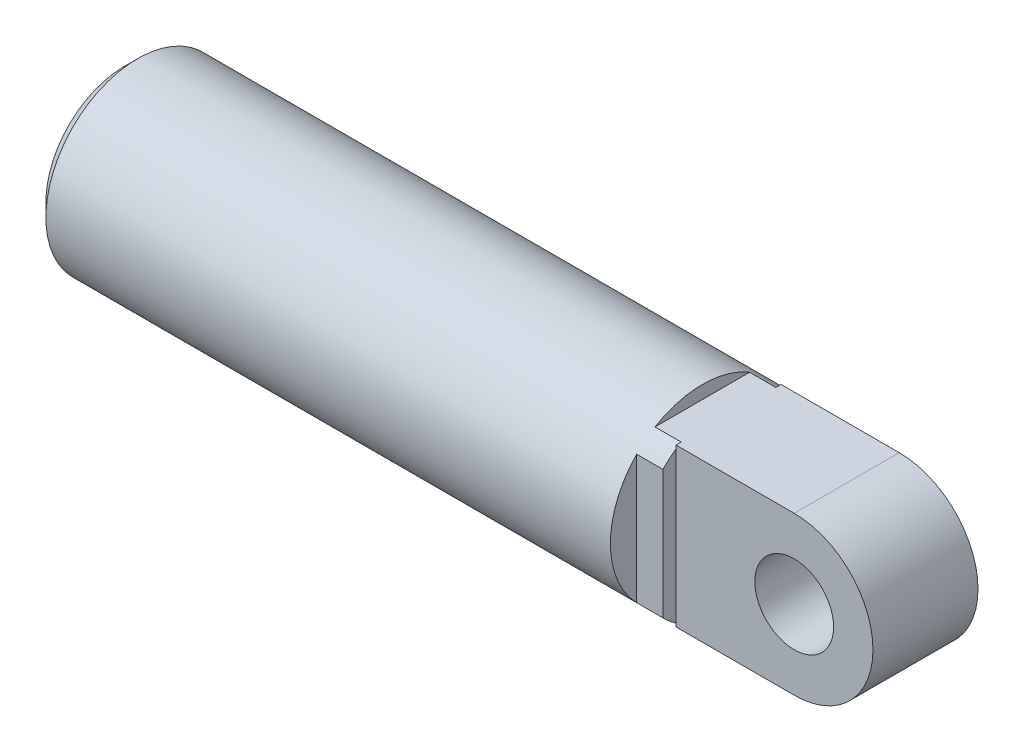
from build123d import *
from build123d.topology import SkipClean

# Parameters (mm, degrees)
SKETCH1_R                   = 7
BOSS_EXTRUDE1_DEPTH         = 44
BOSS_EXTRUDE2_DEPTH         = 2
SKETCH3_R                   = 3
BOSS_EXTRUDE3_DEPTH         = 4
TAP_DRILL_FOR_M5_TAP1_D     = 4.2
TAP_DRILL_FOR_M5_TAP1_DEPTH = 15
TAP_DRILL_FOR_M5_TAP1_TIP   = 1.2618073
CHAMFER1_SIZE               = 1


with BuildPart() as part:
    # Sketch1 → Boss-Extrude1 (new body)
    with BuildSketch(Plane.YZ):
        with Locations(Location((0, 0, 0), (0, 0, 270))):
            Circle(SKETCH1_R)
    extrude(amount=BOSS_EXTRUDE1_DEPTH)

    # Sketch2 → Boss-Extrude2 (add)
    with SkipClean():  # the faces are left unmerged after this step: merging them gives an invalid solid
        with BuildSketch(Plane.YZ.offset(44)):
            with BuildLine():
                Line((-4.898979486, 5), (4.898979486, 5))
                ThreePointArc((4.898979486, 5), (5.4939112, 4.337849667), (6, 3.605551275))
                Line((6, 3.605551275), (6, -3.605551275))
                ThreePointArc((6, -3.605551275), (5.4939112, -4.337849667), (4.898979486, -5))
                Line((4.898979486, -5), (-4.898979486, -5))
                ThreePointArc((-4.898979486, -5), (-5.4939112, -4.337849667), (-6, -3.605551275))
                Line((-6, -3.605551275), (-6, 3.605551275))
                ThreePointArc((-6, 3.605551275), (-5.4939112, 4.337849667), (-4.898979486, 5))
            make_face()
        extrude(amount=BOSS_EXTRUDE2_DEPTH)

    # Sketch3 → Boss-Extrude3 (add, symmetric)
    with SkipClean():  # the faces are left unmerged after this step: merging them gives an invalid solid
        with BuildSketch(Plane(origin=(0, 0, 0), x_dir=(0, 1, 0), z_dir=(0, 0, 1))):
            with BuildLine():
                Line((-6, -46), (6, -46))
                Line((6, -46), (6, -55))
                ThreePointArc((6, -55), (0, -61), (-6, -55))
                Line((-6, -55), (-6, -46))
            make_face()
            with Locations(Location((0, -55, 0), (0, 0, 270))):
                Circle(SKETCH3_R, mode=Mode.SUBTRACT)
        extrude(amount=BOSS_EXTRUDE3_DEPTH, both=True)

    # Tap Drill for M5 Tap1
    with Locations(Plane(origin=(0, 0, 0), x_dir=(0, -1, 0), z_dir=(-1, 0, 0))):
        with Locations((0, 0)):
            Hole(TAP_DRILL_FOR_M5_TAP1_D / 2, depth=TAP_DRILL_FOR_M5_TAP1_DEPTH)
            with Locations((0, 0, -(TAP_DRILL_FOR_M5_TAP1_DEPTH + TAP_DRILL_FOR_M5_TAP1_TIP / 2))):  # 118° drill point
                Cone(0, TAP_DRILL_FOR_M5_TAP1_D / 2, TAP_DRILL_FOR_M5_TAP1_TIP, mode=Mode.SUBTRACT)

    # Chamfer1
    chamfer1_edges = [part.edges().sort_by_distance(p)[0] for p in [
        (0, 0, 7),
    ]]
    chamfer(chamfer1_edges, length=CHAMFER1_SIZE)


solid = part.part
